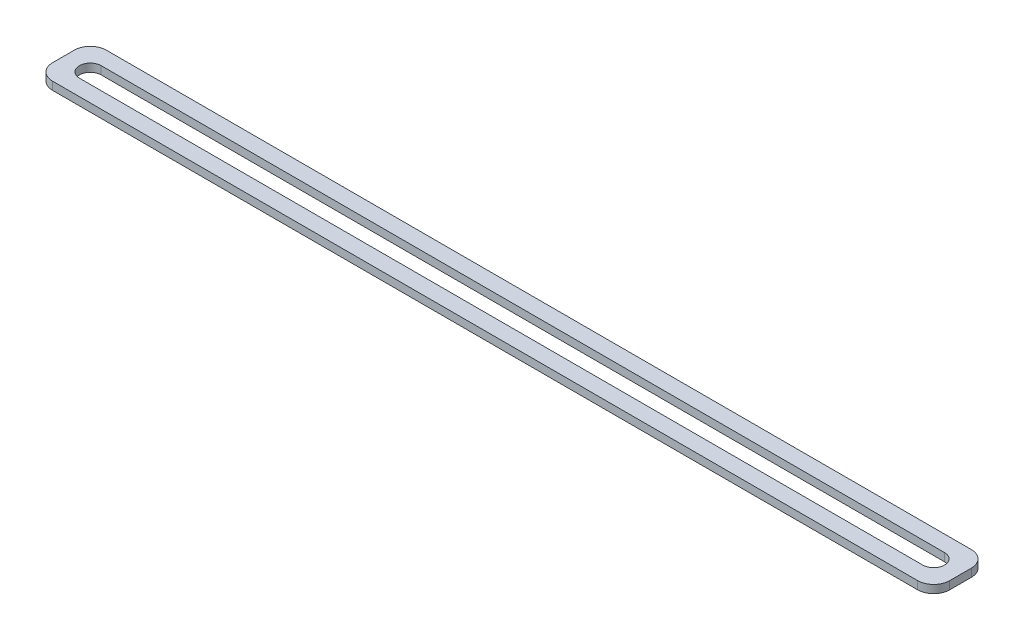
from build123d import *

# Parameters (mm, degrees)
SKETCH1_W           = 177.8
SKETCH1_H           = 10.65
BOSS_EXTRUDE1_DEPTH = 1.5875
FILLET1_R           = 3.175


with BuildPart() as part:
    # Sketch1 → Boss-Extrude1 (new body)
    with BuildSketch(Plane(origin=(0, 0, 0), x_dir=(1, 0, 0), z_dir=(0, 1, 0))):
        Rectangle(SKETCH1_W, SKETCH1_H)
        with BuildLine():
            Line((-83.575, 2.15), (83.575, 2.15))
            ThreePointArc((83.575, 2.15), (85.725, 0), (83.575, -2.15))
            Line((83.575, -2.15), (-83.575, -2.15))
            ThreePointArc((-83.575, -2.15), (-85.725, 0), (-83.575, 2.15))
        make_face(mode=Mode.SUBTRACT)
    extrude(amount=BOSS_EXTRUDE1_DEPTH)

    # Fillet1
    fillet1_edges = [part.edges().sort_by_distance(p)[0] for p in [
        (88.9, 0.79375, 5.325),
        (-88.9, 0.79375, 5.325),
        (-88.9, 0.79375, -5.325),
        (88.9, 0.79375, -5.325),
    ]]
    fillet(fillet1_edges, radius=FILLET1_R)


solid = part.part
